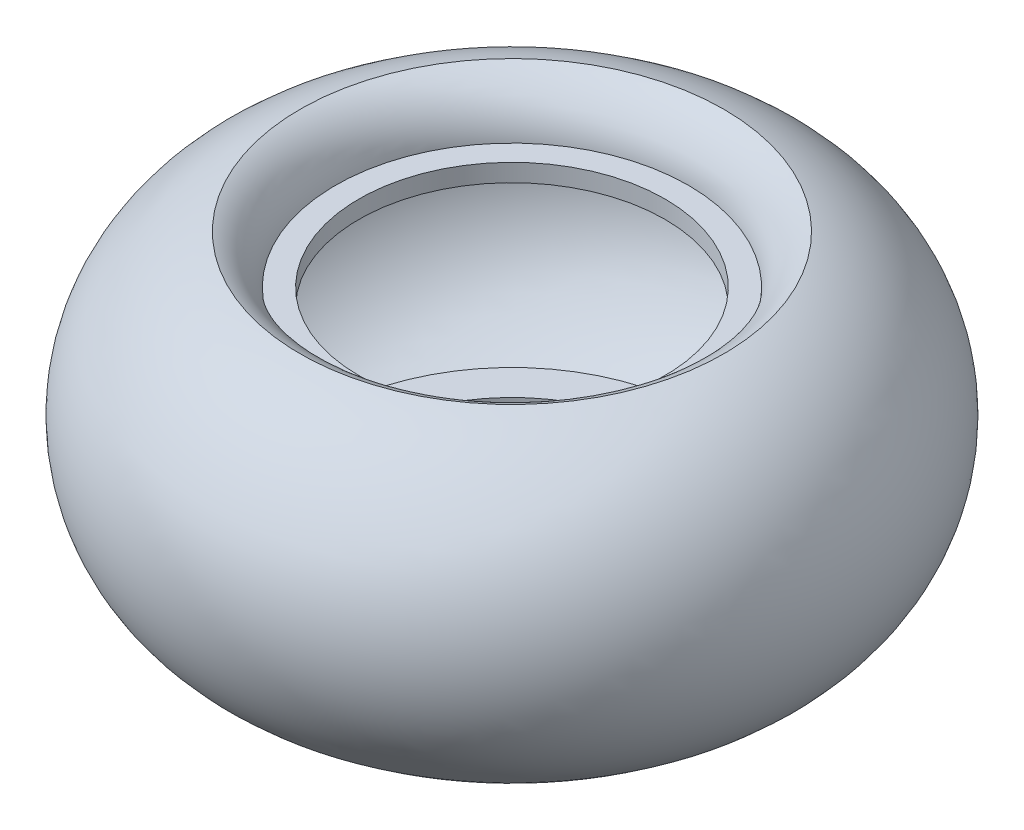
from build123d import *


with BuildPart() as part:
    # Sketch1 → Revolve1 (revolve)
    with BuildSketch(Plane.XY, mode=Mode.PRIVATE) as revolve1_sk:
        with BuildLine():
            Line((15, 9.4), (13, 9.4))
            Line((13, 9.4), (13, 7.9))
            Line((13, 7.9), (16.118143726, 7.9))
            Line((16.118143726, 7.9), (17.962050831, 11.406607374))
            ThreePointArc((17.962050831, 11.406607374), (26, 0), (17.962050831, -11.406607374))
            Line((17.962050831, -11.406607374), (16.118143726, -7.9))
            Line((16.118143726, -7.9), (13, -7.9))
            Line((13, -7.9), (13, -9.4))
            Line((13, -9.4), (15, -9.4))
            ThreePointArc((15, -9.4), (15.940470426, -11.859411884), (18, -13.5))
            ThreePointArc((18, -13.5), (28, 0), (18, 13.5))
            ThreePointArc((18, 13.5), (15.940470426, 11.859411884), (15, 9.4))
        make_face()
    revolve(revolve1_sk.sketch.rotate(Axis((0, 0, 0), (0, 1, 0)), 90), axis=Axis((0, 0, 0), (0, 1, 0)))


solid = part.part
